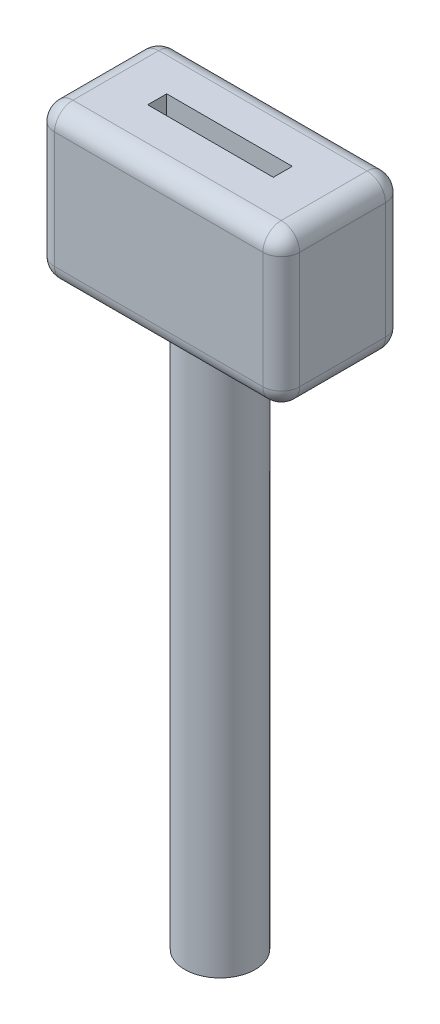
from build123d import *

# Parameters (mm, degrees)
SKETCH_1_R          = 5.75
EXTRUDE_1_DEPTH     = 90
SKETCH_2_W          = 40
SKETCH_2_H          = 20
EXTRUDE_2_DEPTH     = 25
SKETCH_3_W          = 20.5
SKETCH_3_H          = 3.1
CUT_EXTRUDE_1_DEPTH = 20
FILLET_1_R          = 3


with BuildPart() as part:
    # 草图1 → 凸台-拉伸1 (new body)
    with BuildSketch(Plane(origin=(0, 0, 0), x_dir=(1, 0, 0), z_dir=(0, 1, 0))):
        with Locations(Location((0, 0, 0), (0, 0, 90))):
            Circle(SKETCH_1_R)
    extrude(amount=EXTRUDE_1_DEPTH)

    # 草图2 → 凸台-拉伸2 (add)
    with BuildSketch(Plane(origin=(0, 90, 0), x_dir=(1, 0, 0), z_dir=(0, 1, 0))):
        Rectangle(SKETCH_2_W, SKETCH_2_H)
    extrude(amount=EXTRUDE_2_DEPTH)

    # 草图3 → 切除-拉伸1 (cut)
    with BuildSketch(Plane(origin=(0, 115, 0), x_dir=(1, 0, 0), z_dir=(0, 1, 0))):
        Rectangle(SKETCH_3_W, SKETCH_3_H)
    extrude(amount=-CUT_EXTRUDE_1_DEPTH, mode=Mode.SUBTRACT)

    # 圆角1
    fillet_1_edges = [part.edges().sort_by_distance(p)[0] for p in [
        (20, 90, 0),
        (20, 102.5, 10),
        (0, 90, -10),
        (20, 102.5, -10),
        (-20, 90, 0),
        (-20, 102.5, -10),
        (0, 90, 10),
        (-20, 102.5, 10),
        (20, 115, 0),
        (0, 115, -10),
        (-20, 115, 0),
        (0, 115, 10),
    ]]
    fillet(fillet_1_edges, radius=FILLET_1_R)


solid = part.part
